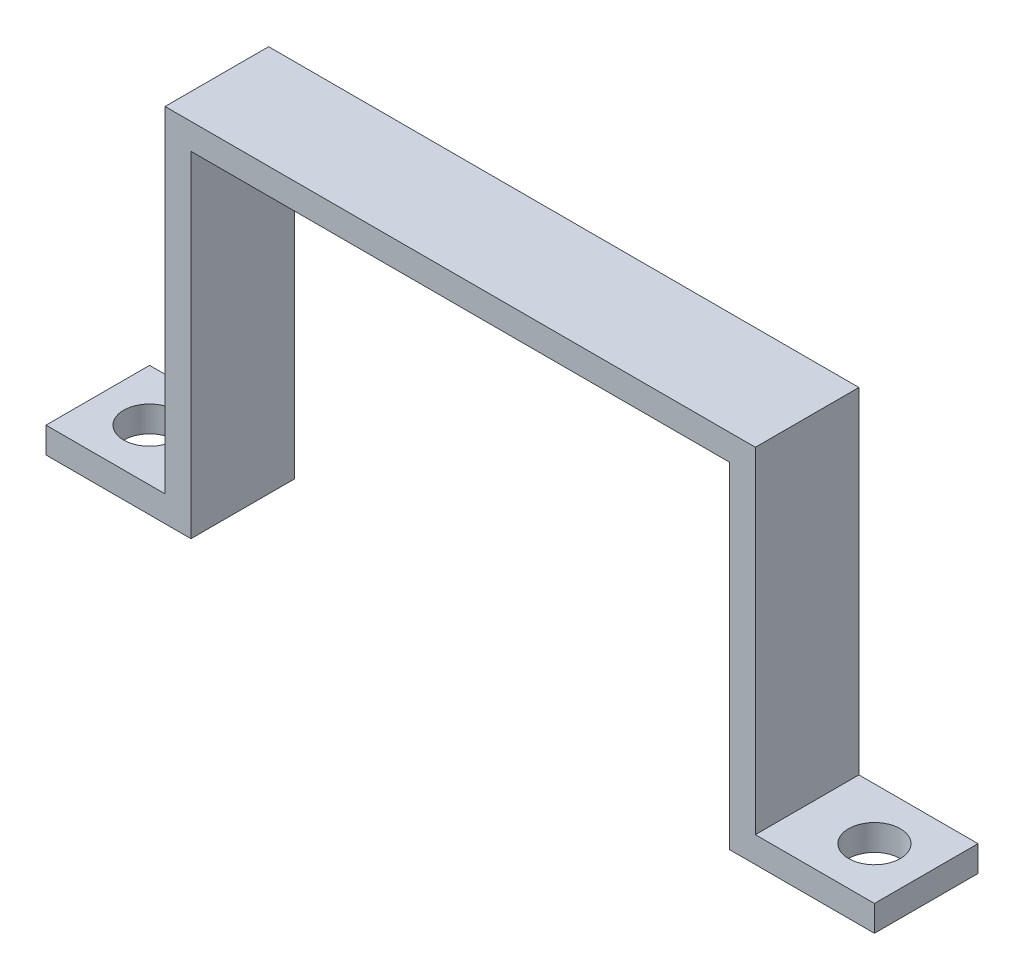
from build123d import *

# Parameters (mm, degrees)
EXTRUDE_THIN1_DEPTH = 3.175
SKETCH2_R           = 1.5875
CUT_EXTRUDE1_DEPTH  = 2.54


with BuildPart() as part:
    # Sketch1 → Extrude-Thin1 (new, symmetric)
    with BuildSketch(Plane.XY):
        Polygon((-25.4, -20.574), (-16.51, -20.574), (-16.51, 0), (16.51, 0), (16.51, -20.574), (25.4, -20.574), (25.4, -18.9865), (18.0975, -18.9865), (18.0975, 1.5875), (-18.0975, 1.5875), (-18.0975, -18.9865), (-25.4, -18.9865), align=None)
    extrude(amount=EXTRUDE_THIN1_DEPTH, both=True)

    # Sketch2 → Cut-Extrude1 (cut)
    with BuildSketch(Plane(origin=(0, -18.9865, 0), x_dir=(1, 0, 0), z_dir=(0, 1, 0))):
        with Locations(Location((22.225, 0, 0), (0, 0, 270))):
            Circle(SKETCH2_R)
    cut_extrude1 = extrude(amount=-CUT_EXTRUDE1_DEPTH, mode=Mode.SUBTRACT)

    # Mirror1: Cut-Extrude1 across plane
    add(cut_extrude1.mirror(Plane(origin=(0, 0, 0), x_dir=(0, 0, 1), z_dir=(1, 0, 0))), mode=Mode.SUBTRACT)


solid = part.part
